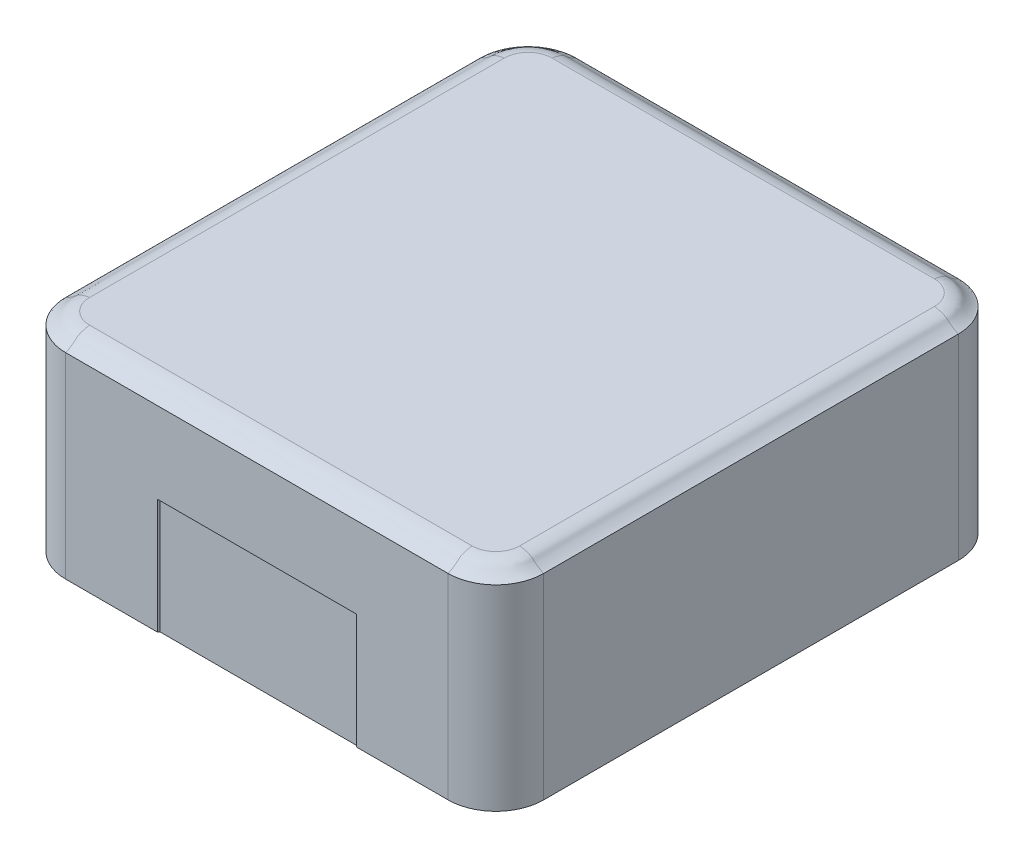
from build123d import *

# Parameters (mm, degrees)
SKETCH_1_W          = 12.6
SKETCH_1_H          = 13.45
EXTRUDE_1_DEPTH     = 5.8
FILLET_1_R          = 1.26
SKETCH_2_W          = 5.5
SKETCH_2_H          = 2.5
CUT_EXTRUDE_1_DEPTH = 0.15
SKETCH_4_W          = 5.25
SKETCH_4_H          = 0.075
CUT_EXTRUDE_2_DEPTH = 3.2


with BuildPart() as part:
    # 草图1 → 凸台-拉伸1 (new body)
    with BuildSketch(Plane(origin=(0, 0, 0), x_dir=(1, 0, 0), z_dir=(0, 1, 0))):
        Rectangle(SKETCH_1_W, SKETCH_1_H)
    extrude(amount=EXTRUDE_1_DEPTH)

    # 圆角1
    fillet_1_edges = [part.edges().sort_by_distance(p)[0] for p in [
        (6.3, 2.9, 6.725),
        (-6.3, 2.9, 6.725),
        (-6.3, 2.9, -6.725),
        (6.3, 2.9, -6.725),
    ]]
    fillet(fillet_1_edges, radius=FILLET_1_R)

    # 草图2 → 切除-拉伸1 (cut)
    with BuildSketch(Plane.XZ):
        with Locations((0, 5.475)):
            Rectangle(SKETCH_2_W, SKETCH_2_H)
        with Locations((0, -5.475)):
            Rectangle(SKETCH_2_W, SKETCH_2_H)
    extrude(amount=-CUT_EXTRUDE_1_DEPTH, mode=Mode.SUBTRACT)

    # 切除-扫描1: sweep along a curve in space
    with BuildLine() as sweep_1_path:
        ThreePointArc((-6.3, 5.8, 5.465), (-5.930954544, 5.8, 6.355954544), (-5.04, 5.8, 6.725))
        Line((-5.04, 5.8, 6.725), (5.04, 5.8, 6.725))
        ThreePointArc((5.04, 5.8, 6.725), (5.930954544, 5.8, 6.355954544), (6.3, 5.8, 5.465))
        Line((6.3, 5.8, 5.465), (6.3, 5.8, -5.465))
        ThreePointArc((6.3, 5.8, -5.465), (5.930954544, 5.8, -6.355954544), (5.04, 5.8, -6.725))
        Line((5.04, 5.8, -6.725), (-5.04, 5.8, -6.725))
        ThreePointArc((-5.04, 5.8, -6.725), (-5.930954544, 5.8, -6.355954544), (-6.3, 5.8, -5.465))
        Line((-6.3, 5.8, -5.465), (-6.3, 5.8, 5.465))
    # 草图3 → 切除-扫描1 (sweep, cut)
    with BuildSketch(Plane(origin=(-5.04, 0, 0), x_dir=(0, 0, -1), z_dir=(1, 0, 0))):
        with BuildLine():
            Line((-6.095, 5.8), (-6.725, 5.8))
            Line((-6.725, 5.8), (-6.725, 5.485))
            add(Edge.make_bspline(
                [(-6.095, 5.8), (-6.115272631, 5.8), (-6.369249056, 5.757113449), (-6.508171408, 5.59551094), (-6.709225012, 5.485), (-6.725, 5.485)],
                knots=[0, 0, 0, 0, 0.46408315, 0.583014262, 1, 1, 1, 1], degree=3))
        make_face()
    sweep_1 = sweep(path=sweep_1_path.line, mode=Mode.SUBTRACT)

    # 镜向1: 切除-扫描1 across plane
    add(sweep_1.mirror(Plane.ZX.offset(2.9)), mode=Mode.SUBTRACT)

    # 草图4 → 切除-拉伸2 (cut)
    with BuildSketch(Plane(origin=(0, 0.15, 0), x_dir=(1, 0, 0), z_dir=(0, 1, 0))):
        with Locations((0, -6.6875)):
            Rectangle(SKETCH_4_W, SKETCH_4_H)
    cut_extrude_2 = extrude(amount=CUT_EXTRUDE_2_DEPTH, mode=Mode.SUBTRACT)

    # 镜向2: 切除-拉伸2 across plane
    add(cut_extrude_2.mirror(Plane.XY), mode=Mode.SUBTRACT)


solid = part.part
